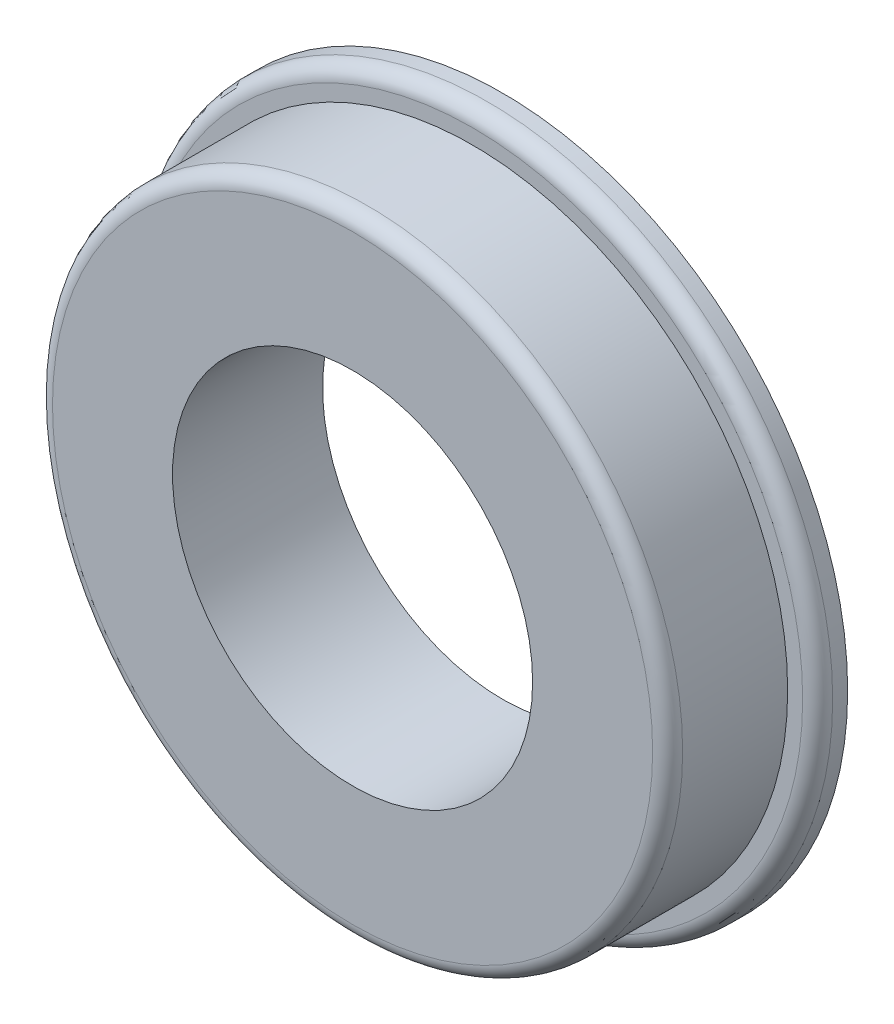
from build123d import *

# Parameters (mm, degrees)
SKETCH_1_R          = 11.5
EXTRUDE_1_DEPTH     = 1
SKETCH_2_R          = 10.5
EXTRUDE_2_DEPTH     = 4
SKETCH_3_R          = 6
CUT_EXTRUDE_1_DEPTH = 9
FILLET_1_R          = 0.5


with BuildPart() as part:
    # ｽｹｯﾁ1 → ﾎﾞｽ - 押し出し1 (new body)
    with BuildSketch(Plane.XY):
        Circle(SKETCH_1_R)
    extrude(amount=EXTRUDE_1_DEPTH)

    # ｽｹｯﾁ2 → ﾎﾞｽ - 押し出し2 (add)
    with BuildSketch(Plane.XY.offset(1)):
        Circle(SKETCH_2_R)
    extrude(amount=EXTRUDE_2_DEPTH)

    # ｽｹｯﾁ3 → ｶｯﾄ - 押し出し1 (cut)
    with BuildSketch(Plane.XY.offset(5)):
        Circle(SKETCH_3_R)
    extrude(amount=-CUT_EXTRUDE_1_DEPTH, mode=Mode.SUBTRACT)

    # ﾌｨﾚｯﾄ1
    fillet_1_edges = [part.edges().sort_by_distance(p)[0] for p in [
        (-11.5, 0, 1),
        (-10.5, 0, 5),
    ]]
    fillet(fillet_1_edges, radius=FILLET_1_R)


solid = part.part
